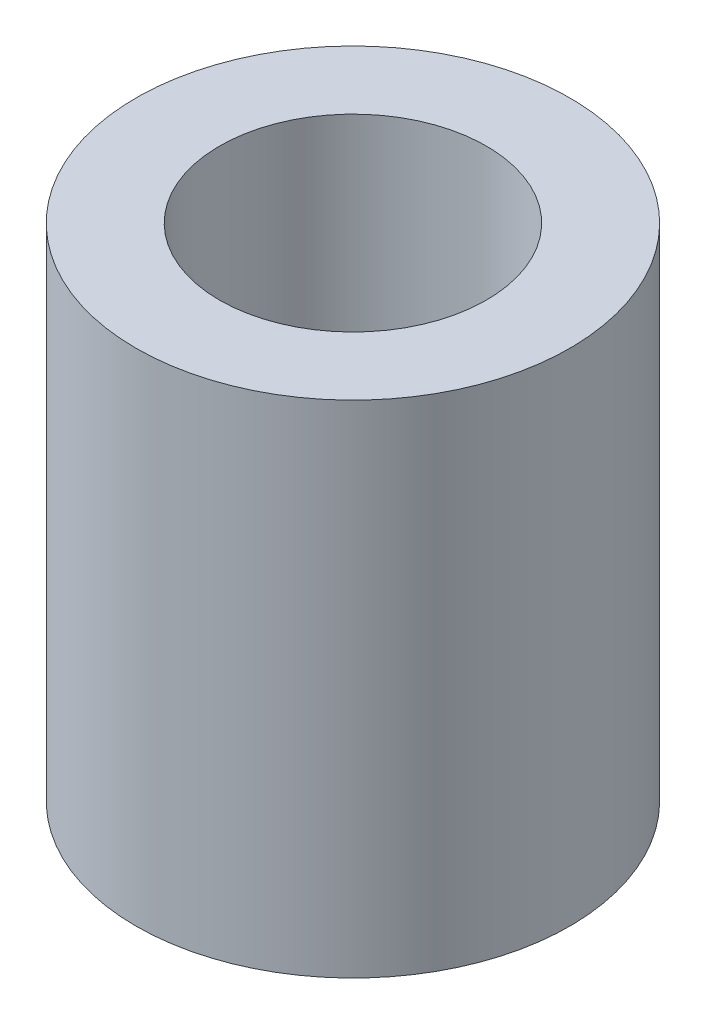
from build123d import *

# Parameters (mm, degrees)
SKETCH1_R           = 6.5
SKETCH1_R_2         = 4
BOSS_EXTRUDE1_DEPTH = 15


with BuildPart() as part:
    # Sketch1 → Boss-Extrude1 (new body)
    with BuildSketch(Plane(origin=(0, 0, 0), x_dir=(1, 0, 0), z_dir=(0, 1, 0))):
        with Locations(Location((0, 0, 0), (0, 0, 270))):
            Circle(SKETCH1_R)
        with Locations(Location((0, 0, 0), (0, 0, 270))):
            Circle(SKETCH1_R_2, mode=Mode.SUBTRACT)
    extrude(amount=BOSS_EXTRUDE1_DEPTH)


solid = part.part
